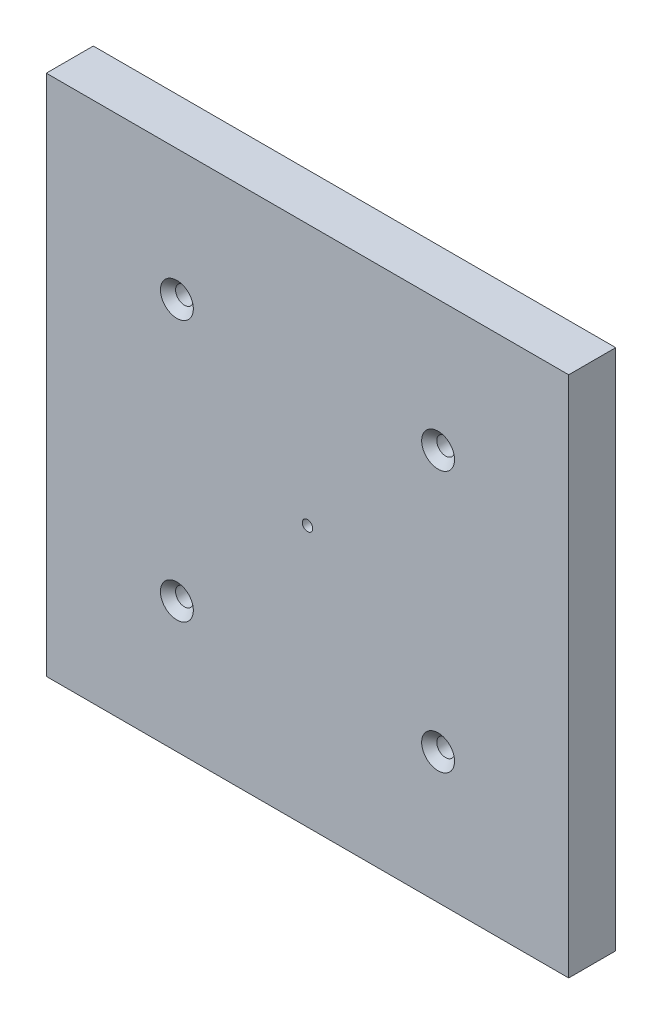
from build123d import *

# Parameters (mm, degrees)
SKETCH_1_W                  = 100
SKETCH_1_H                  = 100
EXTRUDE_1_DEPTH             = 9
HOLE_WIZARD_M3_1_AT_2_COUNT = 2
HOLE_WIZARD_M3_1_AT_2_PITCH = 50
HOLE_WIZARD_M3_1_AT_3_COUNT = 2
HOLE_WIZARD_M3_1_AT_3_PITCH = 70.710678119
HOLE_WIZARD_M3_1_AT_4_COUNT = 2
HOLE_WIZARD_M3_1_AT_4_PITCH = 50


with BuildPart() as part:
    # 草圖1 → 填料-伸長1 (new body)
    with BuildSketch(Plane.XY):
        Rectangle(SKETCH_1_W, SKETCH_1_H)
    extrude(amount=EXTRUDE_1_DEPTH)

    # 草圖4 → M3 平頭機械螺釘的錐孔1 (revolve, cut)
    with BuildSketch(Plane(origin=(-25, 25, 9), x_dir=(0, -1, 0), z_dir=(1, 0, 0))):
        Polygon((0, 0), (0, 9), (1.725, 9), (1.7, 8.975), (1.7, 1.45), (3.15, 0), align=None)
    hole_wizard_m3_1 = revolve(axis=Axis((-25, 25, 15.35), (0, 0, -1)), mode=Mode.SUBTRACT)

    # M3 平頭機械螺釘的錐孔1 at 2: M3 平頭機械螺釘的錐孔1 ×2
    with Locations(*[(i * HOLE_WIZARD_M3_1_AT_2_PITCH, 0, 0) for i in range(1, HOLE_WIZARD_M3_1_AT_2_COUNT)]):
        add(hole_wizard_m3_1, mode=Mode.SUBTRACT)

    # M3 平頭機械螺釘的錐孔1 at 3: M3 平頭機械螺釘的錐孔1 ×2
    with Locations(*[Vector(0.7071067811865476, -0.7071067811865475, 0) * (i * HOLE_WIZARD_M3_1_AT_3_PITCH) for i in range(1, HOLE_WIZARD_M3_1_AT_3_COUNT)]):
        add(hole_wizard_m3_1, mode=Mode.SUBTRACT)

    # M3 平頭機械螺釘的錐孔1 at 4: M3 平頭機械螺釘的錐孔1 ×2
    with Locations(*[(0, -i * HOLE_WIZARD_M3_1_AT_4_PITCH, 0) for i in range(1, HOLE_WIZARD_M3_1_AT_4_COUNT)]):
        add(hole_wizard_m3_1, mode=Mode.SUBTRACT)

    # 草圖8 → Ø2.0mm 定位孔2 (revolve, cut)
    with BuildSketch(Plane(origin=(0, 0, 9), x_dir=(0, -1, 0), z_dir=(1, 0, 0))):
        Polygon((0, 0), (0, 6), (1, 5.399139381), (1, 0), align=None)
    revolve(axis=Axis((0, 0, 15.35), (0, 0, -1)), mode=Mode.SUBTRACT)


solid = part.part
